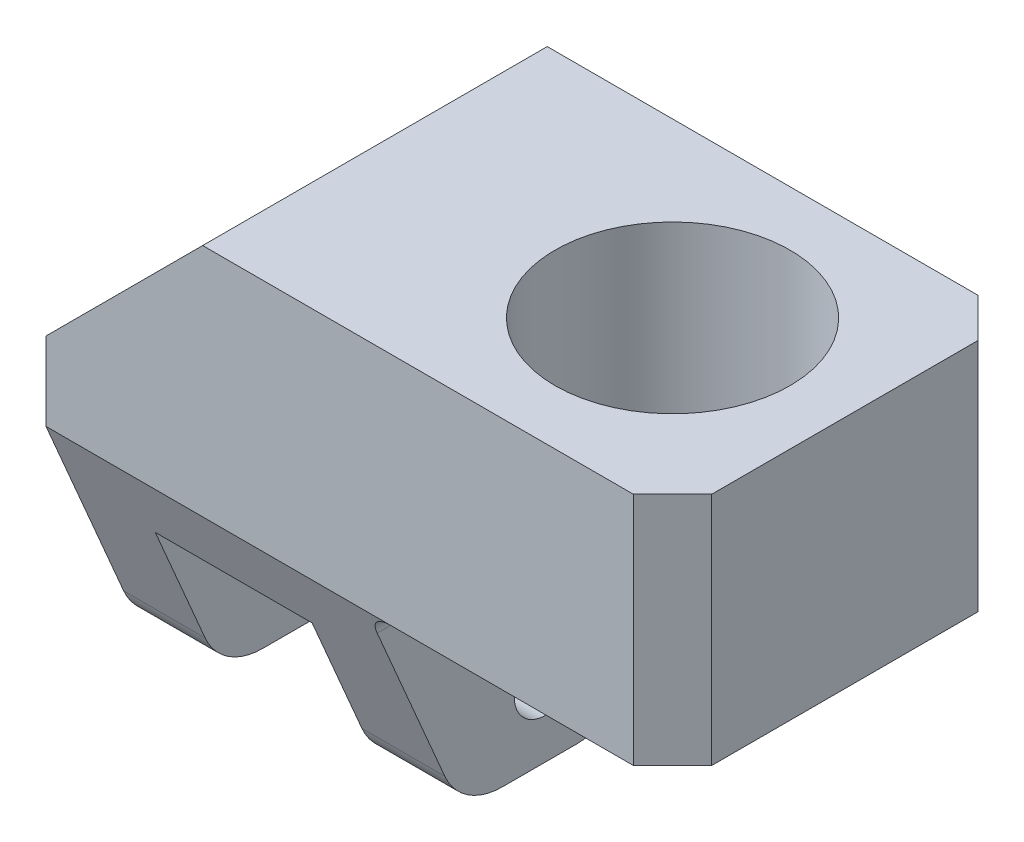
from build123d import *

# Parameters (mm, degrees)
SKETCH_1_W          = 80
SKETCH_1_H          = 44
SKETCH_1_R          = 15
EXTRUDE_1_DEPTH     = 30
CHAMFER_1_SIZE      = 20
SKETCH_2_W          = 41
SKETCH_2_H          = 44
EXTRUDE_2_DEPTH     = 28
SKETCH_3_R          = 4
CUT_EXTRUDE_1_DEPTH = 89.22698
SKETCH_4_W          = 20.030013647
SKETCH_4_H          = 19.701271899
CUT_EXTRUDE_2_DEPTH = 79.74007874
CHAMFER_4_SIZE      = 5
FILLET_1_R          = 3
CUT_EXTRUDE_3_DEPTH = 89.226980059
FILLET_2_R          = 8


with BuildPart() as part:
    # Эскиз1 → Вытянуть1 (new body)
    with BuildSketch(Plane(origin=(0, 0, 0), x_dir=(1, 0, 0), z_dir=(0, 1, 0))):
        with Locations((-18, 0)):
            Rectangle(SKETCH_1_W, SKETCH_1_H)
        with Locations(Location((0, 0, 0), (0, 0, 270))):
            Circle(SKETCH_1_R, mode=Mode.SUBTRACT)
    extrude(amount=EXTRUDE_1_DEPTH)

    # Фаска1
    chamfer_1_edges = [part.edges().sort_by_distance(p)[0] for p in [
        (-58, 30, 0),
    ]]
    chamfer(chamfer_1_edges, length=CHAMFER_1_SIZE)

    # Эскиз2 → Вытянуть2 (add)
    with BuildSketch(Plane.XZ):
        with Locations((-37.5, 0)):
            Rectangle(SKETCH_2_W, SKETCH_2_H)
    extrude(amount=EXTRUDE_2_DEPTH)

    # Эскиз3 → Вырез-Вытянуть1 (cut, through all)
    with BuildSketch(Plane.ZY.offset(58)):
        with Locations((-0.788742376, -18.841346952)):
            Circle(SKETCH_3_R)
    extrude(amount=-CUT_EXTRUDE_1_DEPTH, mode=Mode.SUBTRACT)

    # Эскиз4 → Вырез-Вытянуть2 (cut, through all)
    with BuildSketch(Plane.XY.offset(22)):
        with Locations((-37.59406334, -18.149364051)):
            Rectangle(SKETCH_4_W, SKETCH_4_H)
    extrude(amount=-CUT_EXTRUDE_2_DEPTH, mode=Mode.SUBTRACT)

    # Фаска4
    chamfer_4_edges = [part.edges().sort_by_distance(p)[0] for p in [
        (22, 15, -22),
        (22, 15, 22),
    ]]
    chamfer(chamfer_4_edges, length=CHAMFER_4_SIZE)

    # Скругление1
    fillet_1_edges = [part.edges().sort_by_distance(p)[0] for p in [
        (-17, 0, 0),
    ]]
    fillet(fillet_1_edges, radius=FILLET_1_R)

    # Эскиз5 → Вырез-Вытянуть3 (cut, through all)
    with BuildSketch(Plane.ZY.offset(58)):
        Polygon((-22, 0), (-10, -28), (-22, -28), align=None)
        Polygon((22, -28), (10, -28), (22, 0), align=None)
    extrude(amount=-CUT_EXTRUDE_3_DEPTH, mode=Mode.SUBTRACT)

    # Скругление2
    fillet_2_edges = [part.edges().sort_by_distance(p)[0] for p in [
        (-22.289528258, -28, -10),
        (-52.804535082, -28, -10),
        (-52.804535082, -28, 10),
        (-22.289528258, -28, 10),
    ]]
    fillet(fillet_2_edges, radius=FILLET_2_R)


solid = part.part
